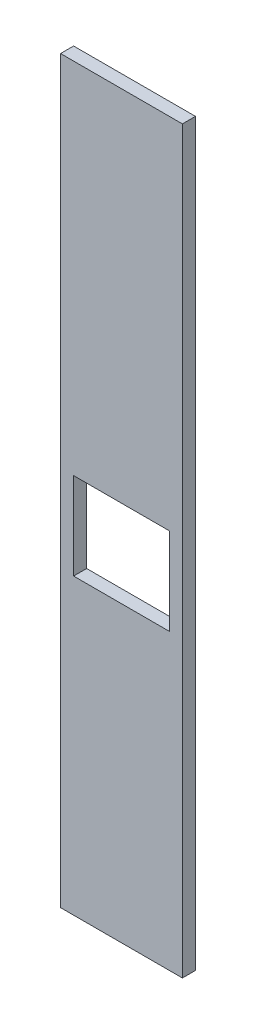
from build123d import *

# Parameters (mm, degrees)
ESQUISSE1_W        = 56
ESQUISSE1_H        = 340
ESQUISSE1_W_2      = 44
ESQUISSE1_H_2      = 40
BOSS_EXTRU_1_DEPTH = 6


with BuildPart() as part:
    # Esquisse1 → Boss.-Extru.1 (new body)
    with BuildSketch(Plane.XY):
        with Locations((-28, 170)):
            Rectangle(ESQUISSE1_W, ESQUISSE1_H)
        with Locations((-28, 155)):
            Rectangle(ESQUISSE1_W_2, ESQUISSE1_H_2, mode=Mode.SUBTRACT)
    extrude(amount=BOSS_EXTRU_1_DEPTH)


solid = part.part
